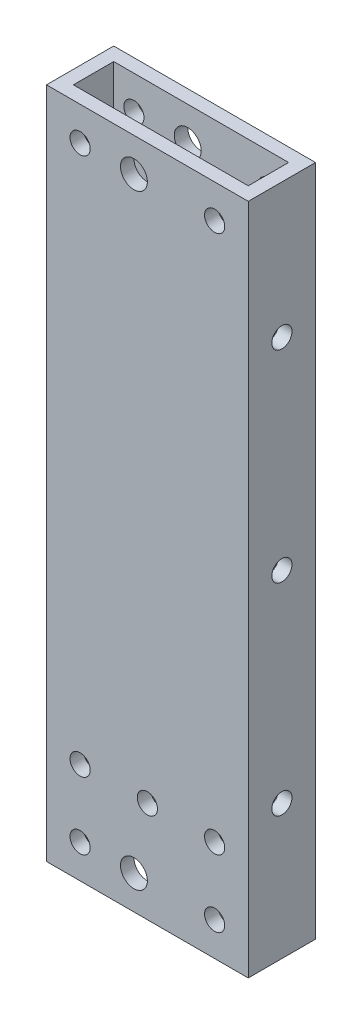
from build123d import *

# Parameters (mm, degrees)
SKETCH_1_W          = 30
SKETCH_1_H          = 10
SKETCH_1_W_2        = 26
SKETCH_1_H_2        = 6
EXTRUDE_1_DEPTH     = 50
SKETCH_2_R          = 2
SKETCH_2_R_2        = 1.5
CUT_EXTRUDE_1_DEPTH = 54.150729064
SKETCH_3_R          = 1.5
CUT_EXTRUDE_2_DEPTH = 54.150729064
SKETCH_4_R          = 1.5
CUT_EXTRUDE_3_DEPTH = 59.523499554


with BuildPart() as part:
    # 草图1 → 凸台-拉伸1 (new, symmetric)
    with BuildSketch(Plane(origin=(0, 0, 0), x_dir=(1, 0, 0), z_dir=(0, 1, 0))):
        Rectangle(SKETCH_1_W, SKETCH_1_H)
        Rectangle(SKETCH_1_W_2, SKETCH_1_H_2, mode=Mode.SUBTRACT)
    extrude(amount=EXTRUDE_1_DEPTH, both=True)

    # 草图2 → 切除-拉伸1 (cut, through all)
    with BuildSketch(Plane(origin=(0, 0, -5), x_dir=(-1, 0, 0), z_dir=(0, 0, -1))):
        with Locations((2, 45)):
            Circle(SKETCH_2_R)
        with Locations((10, 45)):
            Circle(SKETCH_2_R_2)
        with Locations((-10, 45)):
            Circle(SKETCH_2_R_2)
        with Locations((-10, -45)):
            Circle(SKETCH_2_R_2)
        with Locations((2, -45)):
            Circle(SKETCH_2_R)
        with Locations((10, -45)):
            Circle(SKETCH_2_R_2)
    extrude(amount=-CUT_EXTRUDE_1_DEPTH, mode=Mode.SUBTRACT)

    # 草图3 → 切除-拉伸2 (cut, through all)
    with BuildSketch(Plane.XY.offset(5)):
        with Locations((0, -35)):
            Circle(SKETCH_3_R)
        with Locations((10, -35)):
            Circle(SKETCH_3_R)
        with Locations((-10, -35)):
            Circle(SKETCH_3_R)
    extrude(amount=-CUT_EXTRUDE_2_DEPTH, mode=Mode.SUBTRACT)

    # 草图4 → 切除-拉伸3 (cut, through all)
    with BuildSketch(Plane(origin=(15, 0, 0), x_dir=(0, 0, -1), z_dir=(1, 0, 0))):
        with Locations((0, 30)):
            Circle(SKETCH_4_R)
        Circle(SKETCH_4_R)
        with Locations((0, -30)):
            Circle(SKETCH_4_R)
    extrude(amount=-CUT_EXTRUDE_3_DEPTH, mode=Mode.SUBTRACT)


solid = part.part
